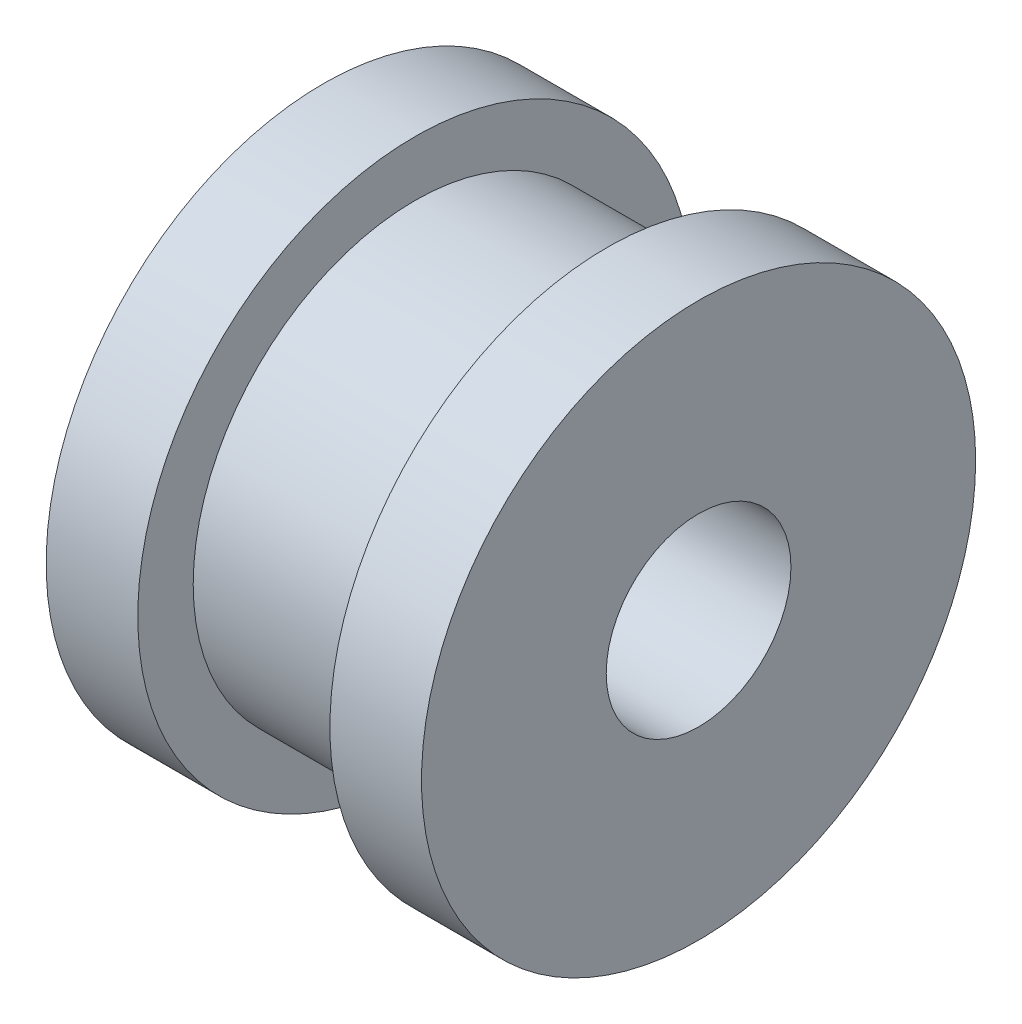
from build123d import *

# Parameters (mm, degrees)
SKETCH1_R           = 9.525
SKETCH1_R_2         = 3.175
BOSS_EXTRUDE1_DEPTH = 3.1496
SKETCH2_R           = 7.62
SKETCH2_R_2         = 3.175
BOSS_EXTRUDE2_DEPTH = 6.604
SKETCH3_R           = 9.525
SKETCH3_R_2         = 3.175
BOSS_EXTRUDE3_DEPTH = 3.1496


with BuildPart() as part:
    # Sketch1 → Boss-Extrude1 (new body)
    with BuildSketch(Plane(origin=(0, 0, 0), x_dir=(0, 0, -1), z_dir=(1, 0, 0))):
        Circle(SKETCH1_R)
        Circle(SKETCH1_R_2, mode=Mode.SUBTRACT)
    extrude(amount=BOSS_EXTRUDE1_DEPTH)

    # Sketch2 → Boss-Extrude2 (add)
    with BuildSketch(Plane(origin=(3.1496, 0, 0), x_dir=(0, 0, -1), z_dir=(1, 0, 0))):
        with Locations(Location((0, 0, 0), (0, 0, 180))):
            Circle(SKETCH2_R)
        Circle(SKETCH2_R_2, mode=Mode.SUBTRACT)
    extrude(amount=BOSS_EXTRUDE2_DEPTH)

    # Sketch3 → Boss-Extrude3 (add)
    with BuildSketch(Plane(origin=(9.7536, 0, 0), x_dir=(0, 0, -1), z_dir=(1, 0, 0))):
        Circle(SKETCH3_R)
        Circle(SKETCH3_R_2, mode=Mode.SUBTRACT)
    extrude(amount=BOSS_EXTRUDE3_DEPTH)


solid = part.part
